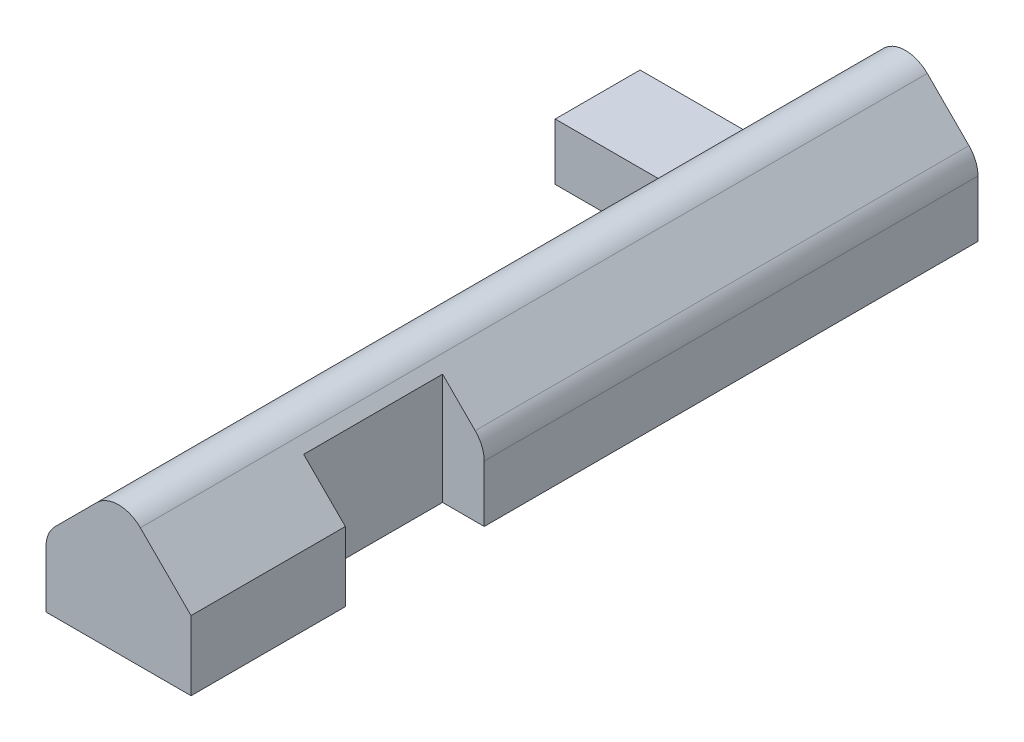
from build123d import *

# Parameters (mm, degrees)
SZKIC1_W                    = 9.4
SZKIC1_H                    = 4.5
DODANIE_WYCI_GNI_CIE1_DEPTH = 51
SZKIC2_W                    = 2.7
SZKIC2_H                    = 9
SZKIC2_W_2                  = 5.3
WYTNIJ_WYCI_GNI_CIE1_DEPTH  = 10
ZAOKR_GLENIE1_R             = 2
SZKIC5_W                    = 7.5
SZKIC5_H                    = 5.5
DODANIE_WYCI_GNI_CIE4_DEPTH = 3.67157


with BuildPart() as part:
    # Szkic1 → Dodanie-wyciągnięcie1 (new body)
    with BuildSketch(Plane.XY):
        Polygon((0, 6.95), (4.7, 2.25), (-4.7, 2.25), align=None)
        Rectangle(SZKIC1_W, SZKIC1_H)
    extrude(amount=DODANIE_WYCI_GNI_CIE1_DEPTH)

    # Szkic2 → Wytnij-wyciągnięcie1 (cut)
    with BuildSketch(Plane.XZ.offset(2.25)):
        with Locations((3.35, 36.5)):
            Rectangle(SZKIC2_W, SZKIC2_H)
        with Locations((7.35, 36.5)):
            Rectangle(SZKIC2_W_2, SZKIC2_H)
    extrude(amount=-WYTNIJ_WYCI_GNI_CIE1_DEPTH, mode=Mode.SUBTRACT)

    # Zaokrąglenie1
    zaokr_glenie1_edges = [part.edges().sort_by_distance(p)[0] for p in [
        (-4.7, 2.25, 25.5),
        (0, 6.95, 25.5),
        (4.7, 2.25, 16),
    ]]
    fillet(zaokr_glenie1_edges, radius=ZAOKR_GLENIE1_R)

    # Szkic5 → Dodanie-wyciągnięcie4 (add)
    with BuildSketch(Plane.XZ.offset(2.25)):
        with Locations((-8.45, 7.75)):
            Rectangle(SZKIC5_W, SZKIC5_H)
    extrude(amount=-DODANIE_WYCI_GNI_CIE4_DEPTH)


solid = part.part
